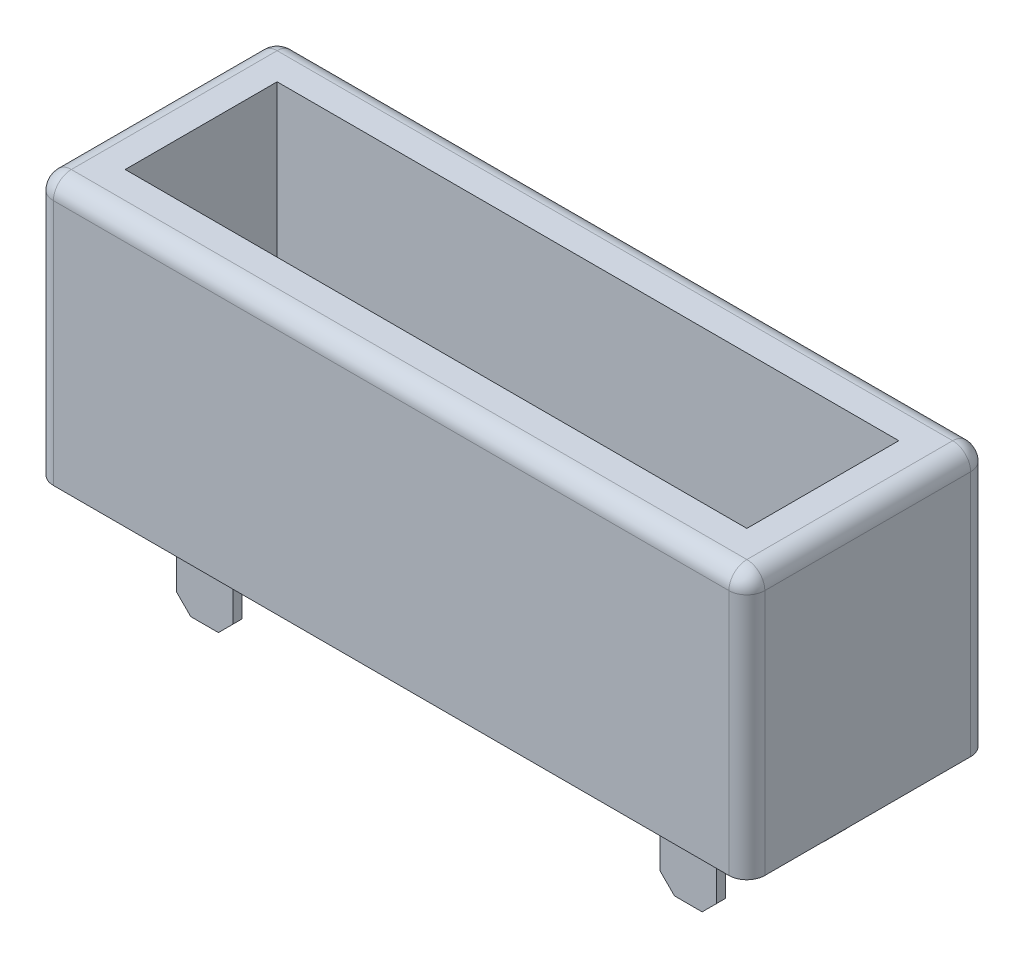
from build123d import *

# Parameters (mm, degrees)
SKETCH1_W           = 19.81
SKETCH1_H           = 6.73
BOSS_EXTRUDE1_DEPTH = 7.37
SKETCH2_W           = 1.57
SKETCH2_H           = 0.25
BOSS_EXTRUDE2_DEPTH = 2.79
CHAMFER1_SIZE       = 0.4
SKETCH3_W           = 17.31
SKETCH3_H           = 4.23
CUT_EXTRUDE1_DEPTH  = 6
FILLET1_R           = 0.5


with BuildPart() as part:
    # Sketch1 → Boss-Extrude1 (new body)
    with BuildSketch(Plane(origin=(0, 0, 0), x_dir=(1, 0, 0), z_dir=(0, 1, 0))):
        with Locations((9.905, 3.365)):
            Rectangle(SKETCH1_W, SKETCH1_H)
    extrude(amount=BOSS_EXTRUDE1_DEPTH)

    # Sketch2 → Boss-Extrude2 (add)
    with BuildSketch(Plane.XZ):
        with Locations((3.17, -5.065)):
            Rectangle(SKETCH2_W, SKETCH2_H)
        with Locations((3.17, -1.665)):
            Rectangle(SKETCH2_W, SKETCH2_H)
        with Locations((16.64, -1.665)):
            Rectangle(SKETCH2_W, SKETCH2_H)
        with Locations((16.64, -5.065)):
            Rectangle(SKETCH2_W, SKETCH2_H)
    extrude(amount=BOSS_EXTRUDE2_DEPTH)

    # Chamfer1
    chamfer1_edges = [part.edges().sort_by_distance(p)[0] for p in [
        (3.955, -2.79, -5.065),
        (2.385, -2.79, -5.065),
        (3.955, -2.79, -1.665),
        (2.385, -2.79, -1.665),
        (17.425, -2.79, -1.665),
        (15.855, -2.79, -1.665),
        (17.425, -2.79, -5.065),
        (15.855, -2.79, -5.065),
    ]]
    chamfer(chamfer1_edges, length=CHAMFER1_SIZE)

    # Sketch3 → Cut-Extrude1 (cut)
    with BuildSketch(Plane(origin=(0, 7.37, 0), x_dir=(1, 0, 0), z_dir=(0, 1, 0))):
        with Locations((9.905, 3.365)):
            Rectangle(SKETCH3_W, SKETCH3_H)
    extrude(amount=-CUT_EXTRUDE1_DEPTH, mode=Mode.SUBTRACT)

    # Fillet1
    fillet1_edges = [part.edges().sort_by_distance(p)[0] for p in [
        (19.81, 7.37, -3.365),
        (9.905, 7.37, -6.73),
        (0, 7.37, -3.365),
        (0, 3.685, -6.73),
        (19.81, 3.685, -6.73),
        (19.81, 3.685, 0),
        (0, 3.685, 0),
        (9.905, 7.37, 0),
    ]]
    fillet(fillet1_edges, radius=FILLET1_R)


solid = part.part
